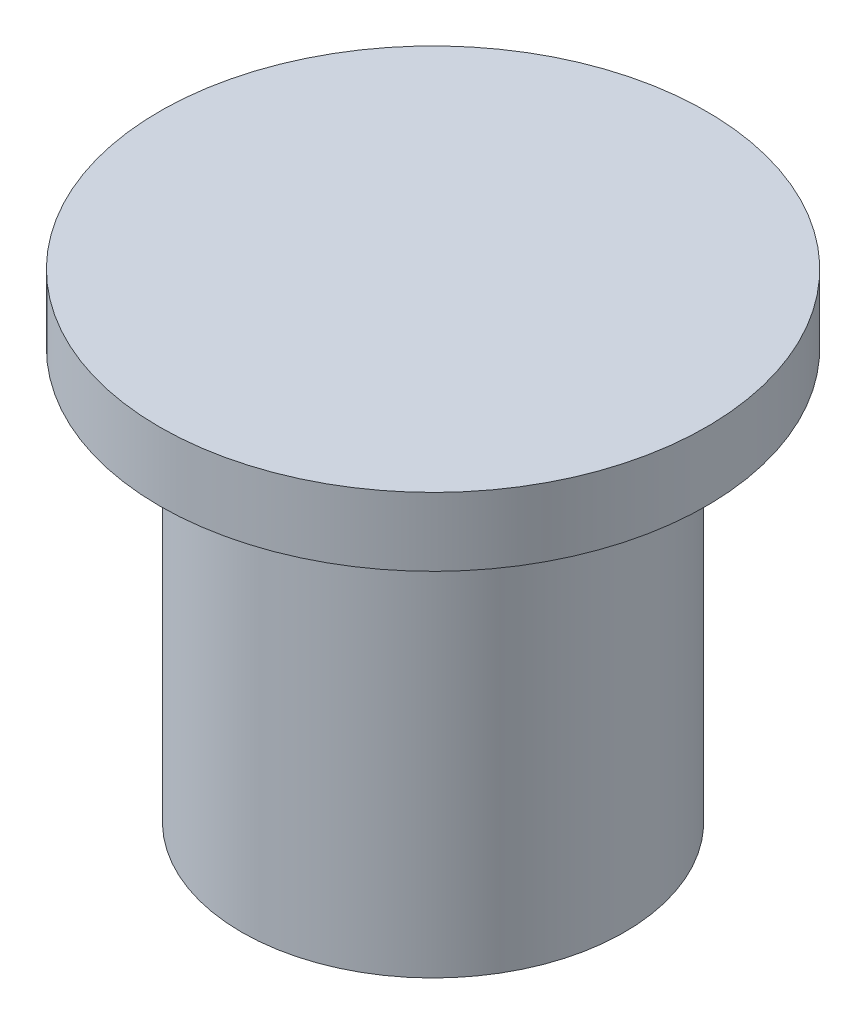
from build123d import *

# Parameters (mm, degrees)
SKETCH_1_R      = 1.4
EXTRUDE_1_DEPTH = 3
SKETCH_2_R      = 2
EXTRUDE_2_DEPTH = 0.5


with BuildPart() as part:
    # 草图1 → 凸台-拉伸1 (new body)
    with BuildSketch(Plane(origin=(0, 0, 0), x_dir=(1, 0, 0), z_dir=(0, 1, 0))):
        with Locations(Location((0, 0, 0), (0, 0, 270))):
            Circle(SKETCH_1_R)
    extrude(amount=EXTRUDE_1_DEPTH)

    # 草图2 → 凸台-拉伸2 (add)
    with BuildSketch(Plane(origin=(0, 3, 0), x_dir=(1, 0, 0), z_dir=(0, 1, 0))):
        with Locations(Location((0, 0, 0), (0, 0, 270))):
            Circle(SKETCH_2_R)
    extrude(amount=EXTRUDE_2_DEPTH)


solid = part.part
